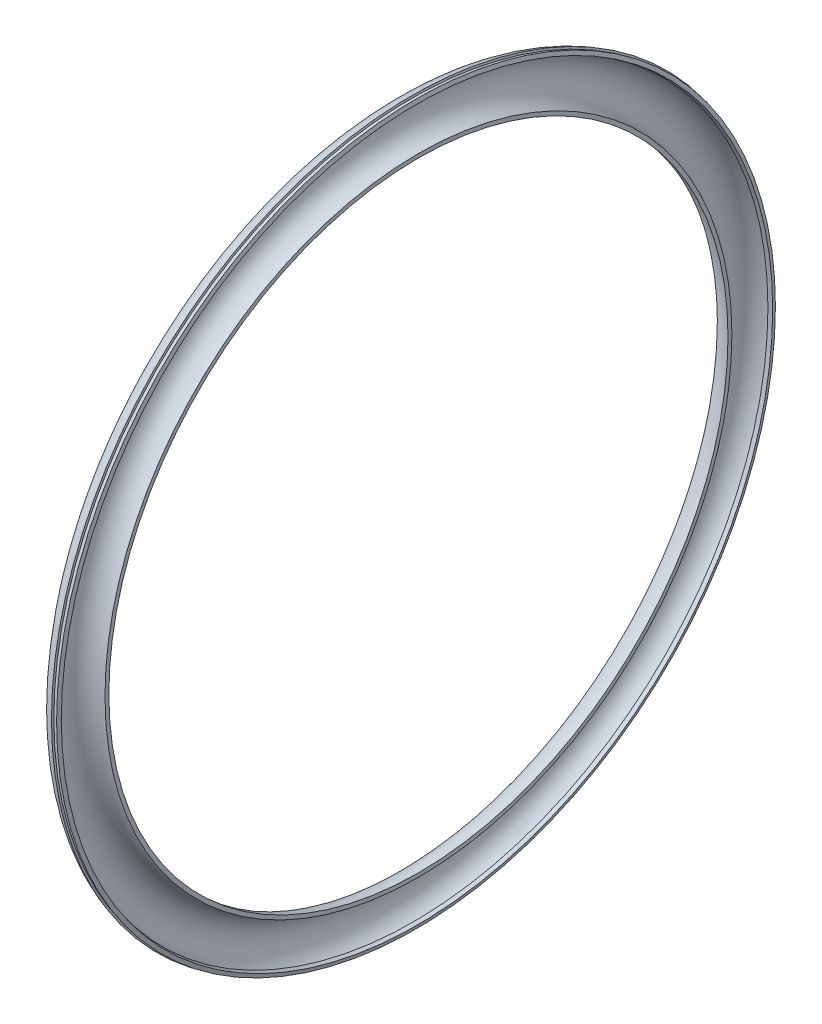
from build123d import *


with BuildPart() as part:
    # Sketch1 → Revolve1 (revolve)
    with BuildSketch(Plane.XY, mode=Mode.PRIVATE) as revolve1_sk:
        with BuildLine():
            Line((-5.176380902, 279.318516526), (-4.788152334, 277.869627786))
            Line((-4.788152334, 277.869627786), (-1.890374856, 278.646084922))
            Line((-1.890374856, 278.646084922), (-1.11391772, 275.748307443))
            Line((-1.11391772, 275.748307443), (-4.011695199, 274.971850307))
            Line((-4.011695199, 274.971850307), (-4.399923767, 276.420739047))
            ThreePointArc((-4.399923767, 276.420739047), (-16.854562643, 257.781054732), (0, 243))
            Line((0, 243), (0, 240))
            ThreePointArc((0, 240), (-19.828897227, 257.389476156), (-5.176380902, 279.318516526))
        make_face()
    revolve(revolve1_sk.sketch.rotate(Axis((157.438506418, 0, 0), (-1, 0, 0)), 90), axis=Axis((157.438506418, 0, 0), (-1, 0, 0)))


solid = part.part
